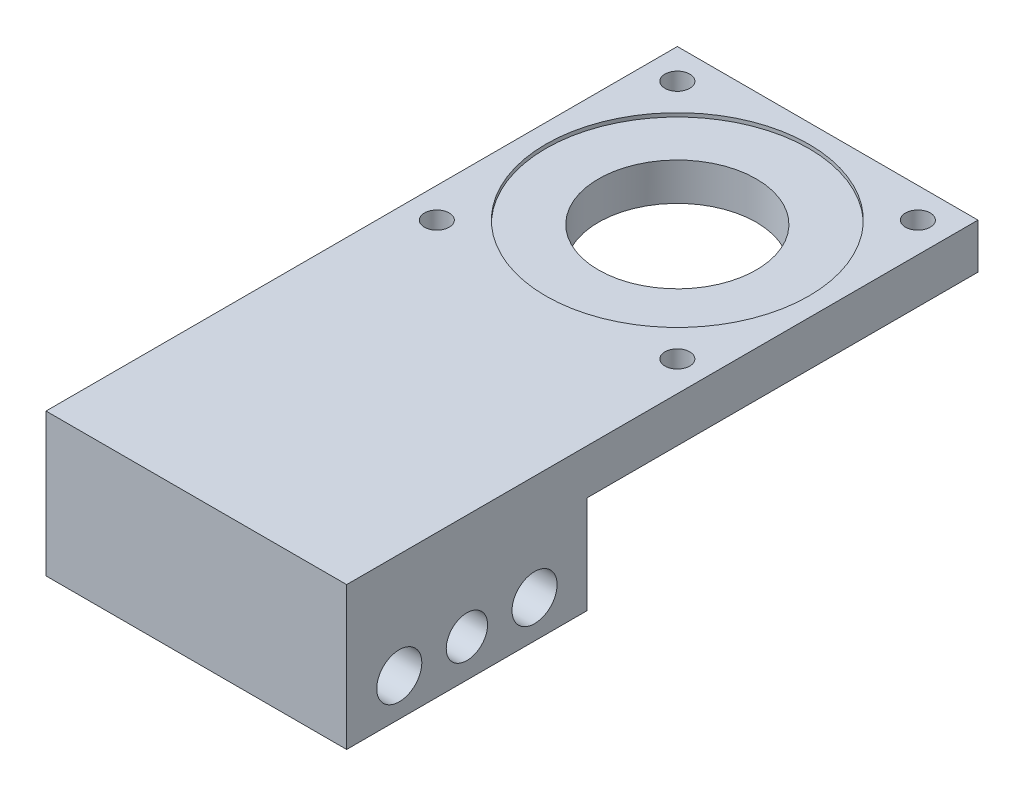
from build123d import *

# Parameters (mm, degrees)
SKETCH1_W             = 40
SKETCH1_H             = 84
SKETCH1_R             = 10.5
BOSS_EXTRUDE1_DEPTH   = 6
SKETCH2_W             = 40
SKETCH2_H             = 32
BOSS_EXTRUDE2_DEPTH   = 13
F_6_0MM_DOWEL_HOLE1_D = 6
M5_CLEARANCE_HOLE1_D  = 5.5
M4X0_7_TAPPED_HOLE1_D = 3.3
SKETCH12_R            = 17.5
CUT_EXTRUDE1_DEPTH    = 0.5
CUT_EXTRUDE2_START    = -0.5
SKETCH13_R            = 17.5
CUT_EXTRUDE2_DEPTH    = 0.5


with BuildPart() as part:
    # Sketch1 → Boss-Extrude1 (new body)
    with BuildSketch(Plane(origin=(0, 0, 0), x_dir=(1, 0, 0), z_dir=(0, 1, 0))):
        with Locations((0, -22)):
            Rectangle(SKETCH1_W, SKETCH1_H)
        with Locations(Location((0, 0, 0), (0, 0, 270))):
            Circle(SKETCH1_R, mode=Mode.SUBTRACT)
    extrude(amount=BOSS_EXTRUDE1_DEPTH)

    # Sketch2 → Boss-Extrude2 (add)
    with BuildSketch(Plane.XZ):
        with Locations((0, 48)):
            Rectangle(SKETCH2_W, SKETCH2_H)
    extrude(amount=BOSS_EXTRUDE2_DEPTH)

    # Ø6.0mm Dowel Hole1 (through all)
    with Locations(Plane(origin=(20, 0, 0), x_dir=(0, 0, -1), z_dir=(1, 0, 0))):
        with Locations((-57, -8), (-39, -8)):
            Hole(F_6_0MM_DOWEL_HOLE1_D / 2)

    # M5 Clearance Hole1 (through all)
    with Locations(Plane.ZY.offset(20)):
        with Locations((48, -8)):
            Hole(M5_CLEARANCE_HOLE1_D / 2)

    # M4x0.7 Tapped Hole1 (through all)
    with Locations(Plane(origin=(0, 0, 0), x_dir=(-1, 0, 0), z_dir=(0, -1, 0))):
        with Locations((16, 16), (-16, 16), (-16, -16), (16, -16)):
            Hole(M4X0_7_TAPPED_HOLE1_D / 2)

    # Sketch12 → Cut-Extrude1 (cut)
    with BuildSketch(Plane(origin=(0, 6, 0), x_dir=(1, 0, 0), z_dir=(0, 1, 0))):
        with Locations(Location((0, 0, 0), (0, 0, 270))):
            Circle(SKETCH12_R)
    extrude(amount=-CUT_EXTRUDE1_DEPTH, mode=Mode.SUBTRACT)

    # Sketch13 → Cut-Extrude2 (cut)
    with BuildSketch(Plane.XZ.offset(CUT_EXTRUDE2_START)):
        with Locations(Location((0, 0, 0), (0, 0, 90))):
            Circle(SKETCH13_R)
    extrude(amount=CUT_EXTRUDE2_DEPTH, mode=Mode.SUBTRACT)


solid = part.part
